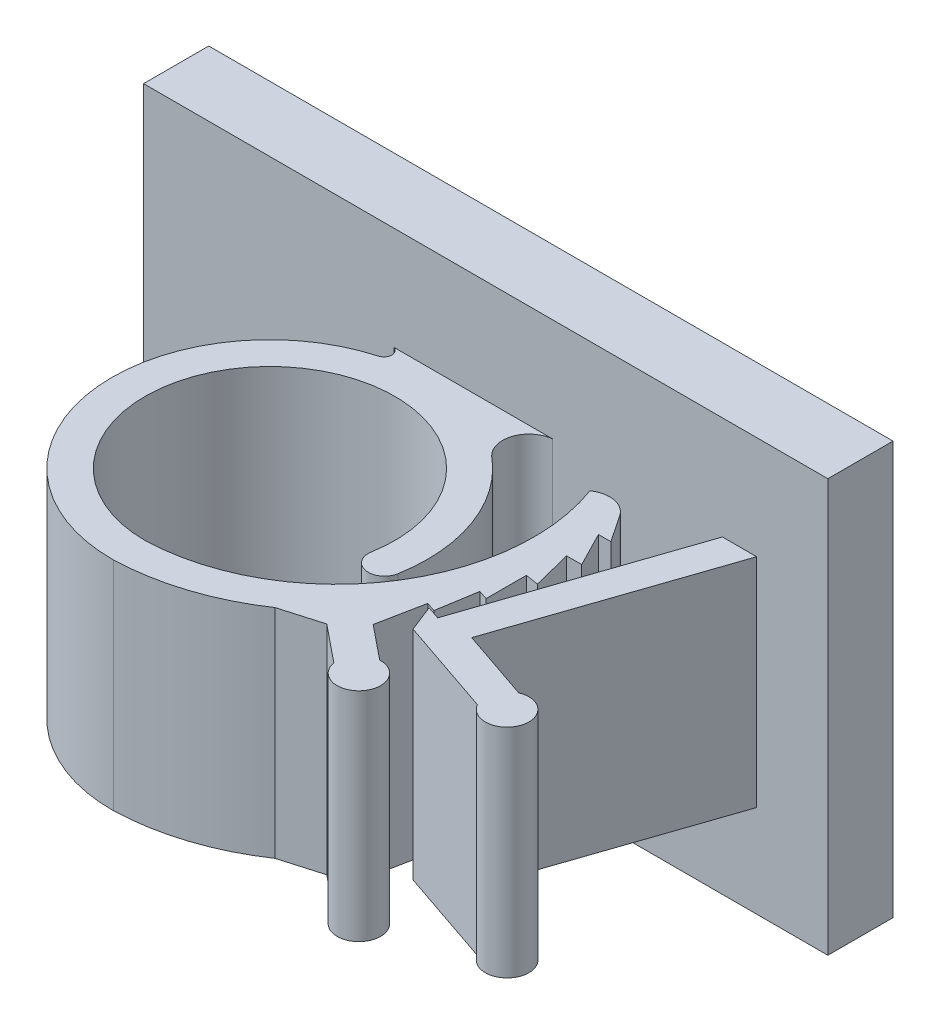
from build123d import *

# Parameters (mm, degrees)
ESQUISSE1_W      = 31.5
ESQUISSE1_H      = 19
EXTRUSION1_DEPTH = 3
EXTRUSION2_DEPTH = 5


with BuildPart() as part:
    # Esquisse1 → Extrusion1 (new body)
    with BuildSketch(Plane.XY):
        with Locations((-6.993175074, -6.195994065)):
            Rectangle(ESQUISSE1_W, ESQUISSE1_H)
    extrude(amount=-EXTRUSION1_DEPTH)

    # Esquisse2 → Extrusion2 (add, symmetric)
    with BuildSketch(Plane(origin=(0, -6.445994065, 0), x_dir=(-1, 0, 0), z_dir=(0, 1, 0))):
        with BuildLine():
            Line((-0.683946914, 1.503708235), (-1.522862282, 2.753870501))
            Line((-1.522862282, 2.753870501), (-0.951110198, 2.753870501))
            Line((-0.951110198, 2.753870501), (-1.764464322, 4.339195483))
            Line((-1.764464322, 4.339195483), (-1.070373593, 4.339195483))
            Line((-1.070373593, 4.339195483), (-1.522862282, 6.137827556))
            Line((-1.522862282, 6.137827556), (-0.919586302, 6.039619438))
            Line((-0.919586302, 6.039619438), (-0.919586302, 7.896542483))
            Line((-0.919586302, 7.896542483), (-0.491311221, 7.750686861))
            Line((-0.491311221, 7.750686861), (-0.194631359, 9.573141446))
            Line((-0.194631359, 9.573141446), (0.23155106, 9.427998511))
            Line((0.23155106, 9.427998511), (0.646902561, 11.526197473))
            Line((0.646902561, 11.526197473), (-0.919586302, 12.794183433))
            ThreePointArc((-0.919586302, 12.794183433), (-1.739109574, 14.422451612), (0.024155253, 13.960095898))
            Line((0.024155253, 13.960095898), (1.735137514, 12.575150538))
            Line((1.735137514, 12.575150538), (3.580381554, 13.110240468))
            ThreePointArc((3.580381554, 13.110240468), (6.259156873, 14.419297059), (9.196563315, 14.930286061))
            ThreePointArc((9.196563315, 14.930286061), (16.439211341, 8.707680897), (11.226331582, 0.70751527))
            ThreePointArc((11.226331582, 0.70751527), (10.958201165, 0.354142581), (11.225313893, 0))
            Line((11.225313893, 0), (3.908893256, 0))
            ThreePointArc((3.908893256, 0), (4.942460115, 0.812425826), (4.628744056, 2.089092739))
            ThreePointArc((4.628744056, 2.089092739), (2.440830828, 5.172896926), (2.103130606, 8.938898932))
            ThreePointArc((2.103130606, 8.938898932), (2.971882266, 9.547397538), (3.580380872, 8.678645878))
            ThreePointArc((3.580380872, 8.678645878), (12.939531774, 3.276526542), (9.243174696, 13.431010442))
            ThreePointArc((9.243174696, 13.431010442), (1.988346124, 9.431080483), (0.985709709, 1.207535171))
            ThreePointArc((0.985709709, 1.207535171), (0.089542016, 1.009824881), (-0.683946914, 1.503708235))
        make_face()
        with BuildLine():
            Line((0.024155253, 9.573141446), (-0.573596034, 9.77671478))
            Line((-0.573596034, 9.77671478), (-3.903205639, 0))
            Line((-3.903205639, 0), (-5.477057205, 0))
            Line((-5.477057205, 0), (-2.145067788, 9.78370261))
            Line((-2.145067788, 9.78370261), (-5.43013268, 10.902481655))
            ThreePointArc((-5.43013268, 10.902481655), (-6.770419213, 12.151238044), (-4.946559165, 12.322395968))
            Line((-4.946559165, 12.322395968), (-0.453501716, 10.7922166))
            Line((-0.453501716, 10.7922166), (0.024155253, 9.573141446))
        make_face()
    extrude(amount=EXTRUSION2_DEPTH, both=True)


solid = part.part
